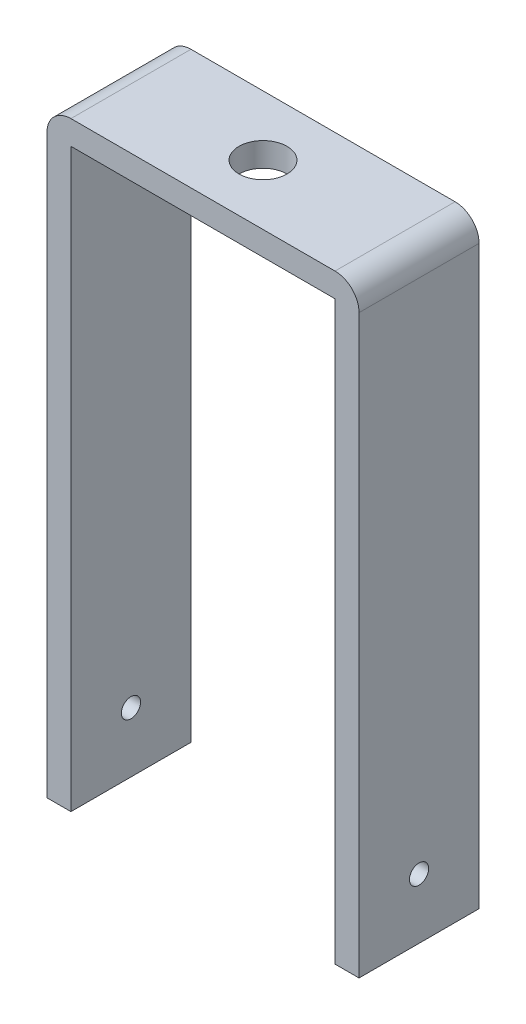
from build123d import *

# Parameters (mm, degrees)
SKETCH1_W           = 110
SKETCH1_H           = 10
SKETCH1_W_2         = 10
SKETCH1_H_2         = 250
BOSS_EXTRUDE1_DEPTH = 50
FILLET1_R           = 10
SKETCH2_R           = 4
CUT_EXTRUDE1_DEPTH  = 149
SKETCH3_R           = 10
CUT_EXTRUDE2_DEPTH  = 10


with BuildPart() as part:
    # Sketch1 → Boss-Extrude1 (new body)
    with BuildSketch(Plane.XY):
        with Locations((65, -5)):
            Rectangle(SKETCH1_W, SKETCH1_H)
        with Locations((5, -125)):
            Rectangle(SKETCH1_W_2, SKETCH1_H_2)
        Polygon((130, 0), (120, 0), (120, -10), (120, -250), (130, -250), align=None)
    extrude(amount=BOSS_EXTRUDE1_DEPTH)

    # Fillet1
    fillet1_edges = [part.edges().sort_by_distance(p)[0] for p in [
        (0, 0, 25),
        (130, 0, 25),
    ]]
    fillet(fillet1_edges, radius=FILLET1_R)

    # Sketch2 → Cut-Extrude1 (cut)
    with BuildSketch(Plane(origin=(130, 0, 0), x_dir=(0, 0, -1), z_dir=(1, 0, 0))):
        with Locations(Location((-25, -225, 0), (0, 0, 90))):
            Circle(SKETCH2_R)
    extrude(amount=-CUT_EXTRUDE1_DEPTH, mode=Mode.SUBTRACT)

    # Sketch3 → Cut-Extrude2 (cut)
    with BuildSketch(Plane(origin=(0, 0, 0), x_dir=(1, 0, 0), z_dir=(0, 1, 0))):
        with Locations(Location((65, -25, 0), (0, 0, 270))):
            Circle(SKETCH3_R)
    extrude(amount=-CUT_EXTRUDE2_DEPTH, mode=Mode.SUBTRACT)


solid = part.part
